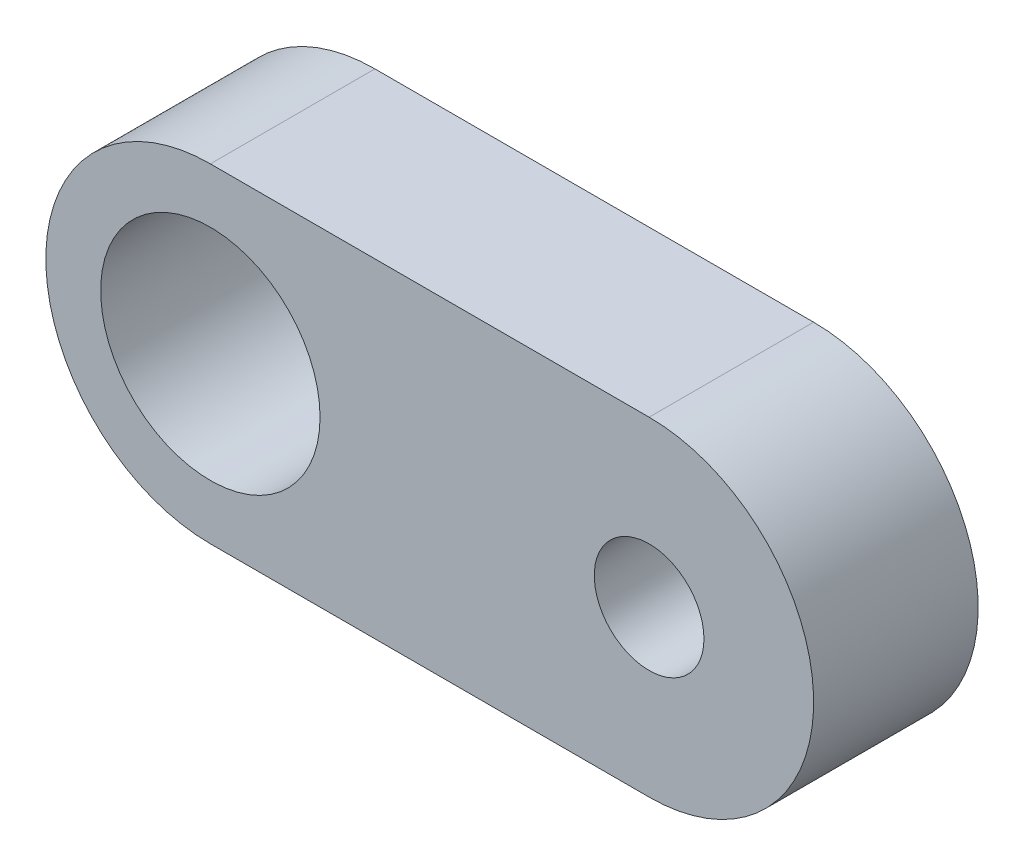
from build123d import *

# Parameters (mm, degrees)
SKETCH_1_R      = 2
SKETCH_1_R_2    = 1
EXTRUDE_1_DEPTH = 3


with BuildPart() as part:
    # Эскиз1 → Бобышка-Вытянуть1 (new body)
    with BuildSketch(Plane.XY):
        with BuildLine():
            Line((0, 3), (8, 3))
            ThreePointArc((8, 3), (10.121320344, 2.121320344), (11, 0))
            ThreePointArc((11, 0), (10.121320344, -2.121320344), (8, -3))
            Line((8, -3), (0, -3))
            ThreePointArc((0, -3), (-3, 0), (0, 3))
        make_face()
        Circle(SKETCH_1_R, mode=Mode.SUBTRACT)
        with Locations((8, 0)):
            Circle(SKETCH_1_R_2, mode=Mode.SUBTRACT)
    extrude(amount=EXTRUDE_1_DEPTH)


solid = part.part
